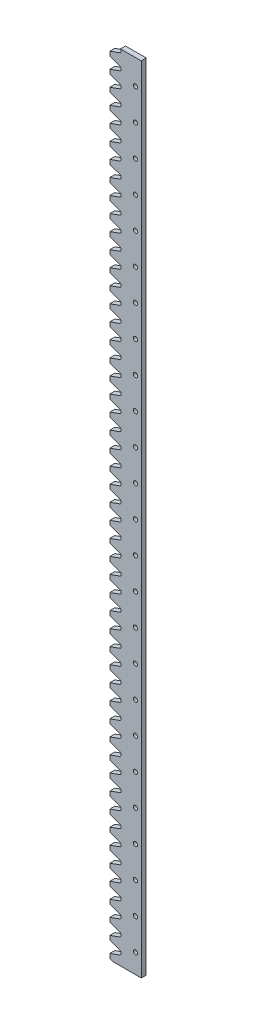
from build123d import *

# Parameters (mm, degrees)
CI_DEPTH                   = 1.5
CI_DEPTH_BACK              = 1.5
SKETCHCI_M_STRSKETCHNAME_W = 22.049999955
SKETCHCI_M_STRSKETCHNAME_H = 565.486669154
CUT_EXTRUDE_547_DEPTH      = 1.5
PATTERN_LINEAR_604_COUNT   = 60
PATTERN_LINEAR_604_PITCH   = 9.424777961
SKETCH_1_R                 = 1.275
SKETCH_1_W                 = 22.049999955
SKETCH_1_H                 = 12.569555851
SKETCH_1_H_2               = 53.917113303
CUT_EXTRUDE_1_DEPTH        = 562.105779584
SKETCH_2_W                 = 3.05
SKETCH_2_H                 = 499
CUT_EXTRUDE_2_DEPTH        = 10
SKETCH_3_W                 = 35.848320486
SKETCH_3_H                 = 14.718370521
SKETCH_3_W_2               = 40.105806215
SKETCH_3_H_2               = 50.96151316
CUT_EXTRUDE_3_DEPTH        = 10


with BuildPart() as part:
    # SketchCI.m_strSketchName → 拉伸CI (new, two sides: drawn at the far end of the back side and taken through both)
    with BuildSketch(Plane.XY.offset(-CI_DEPTH_BACK)):
        with Locations((8.025000023, -278.030945667)):
            Rectangle(SKETCHCI_M_STRSKETCHNAME_W, SKETCHCI_M_STRSKETCHNAME_H)
    extrude(amount=CI_DEPTH + CI_DEPTH_BACK)

    # Sketch 439 → Cut-Extrude 547 (cut, symmetric)
    with BuildSketch(Plane.XY):
        with BuildLine():
            Line((-2.999999955, 3.448105141), (-2.999999955, -3.448105141))
            Line((-2.999999955, -3.448105141), (3.157818082, -1.206842668))
            ThreePointArc((3.157818082, -1.206842668), (3.587236786, -0.877338107), (3.749999944, -0.361119322))
            Line((3.749999944, -0.361119322), (3.749999944, 0.361119322))
            ThreePointArc((3.749999944, 0.361119322), (3.587236786, 0.877338107), (3.157818082, 1.206842668))
            Line((3.157818082, 1.206842668), (-2.999999955, 3.448105141))
        make_face()
    cut_extrude_547 = extrude(amount=CUT_EXTRUDE_547_DEPTH, both=True, mode=Mode.SUBTRACT)

    # Pattern Linear 604: Cut-Extrude 547 ×60
    with Locations(*[(0, -i * PATTERN_LINEAR_604_PITCH, 0) for i in range(1, PATTERN_LINEAR_604_COUNT)]):
        add(cut_extrude_547, mode=Mode.SUBTRACT)

    # 草图1 → 切除-拉伸1 (cut, through all)
    with BuildSketch(Plane.XY.offset(1.5)):
        with Locations((12.5, -14.137166941)):
            Circle(SKETCH_1_R)
        with Locations((12.5, -32.977166941)):
            Circle(SKETCH_1_R)
        with Locations((12.5, -51.817166941)):
            Circle(SKETCH_1_R)
        with Locations((12.5, -70.657166941)):
            Circle(SKETCH_1_R)
        with Locations((12.5, -89.497166941)):
            Circle(SKETCH_1_R)
        with Locations((12.5, -108.337166941)):
            Circle(SKETCH_1_R)
        with Locations((12.5, -127.177166941)):
            Circle(SKETCH_1_R)
        with Locations((12.5, -146.017166941)):
            Circle(SKETCH_1_R)
        with Locations((12.5, -164.857166941)):
            Circle(SKETCH_1_R)
        with Locations((12.5, -183.697166941)):
            Circle(SKETCH_1_R)
        with Locations((12.5, -202.537166941)):
            Circle(SKETCH_1_R)
        with Locations((12.5, -221.377166941)):
            Circle(SKETCH_1_R)
        with Locations((12.5, -240.217166941)):
            Circle(SKETCH_1_R)
        with Locations((12.5, -259.057166941)):
            Circle(SKETCH_1_R)
        with Locations((12.5, -277.897166941)):
            Circle(SKETCH_1_R)
        with Locations((12.5, -296.737166941)):
            Circle(SKETCH_1_R)
        with Locations((12.5, -315.577166941)):
            Circle(SKETCH_1_R)
        with Locations((12.5, -334.417166941)):
            Circle(SKETCH_1_R)
        with Locations((12.5, -353.257166941)):
            Circle(SKETCH_1_R)
        with Locations((12.5, -372.097166941)):
            Circle(SKETCH_1_R)
        with Locations((12.5, -390.937166941)):
            Circle(SKETCH_1_R)
        with Locations((12.5, -409.777166941)):
            Circle(SKETCH_1_R)
        with Locations((12.5, -428.617166941)):
            Circle(SKETCH_1_R)
        with Locations((12.5, -447.457166941)):
            Circle(SKETCH_1_R)
        with Locations((12.5, -466.297166941)):
            Circle(SKETCH_1_R)
        with Locations((12.5, -485.137166941)):
            Circle(SKETCH_1_R)
        with Locations((12.5, -503.977166941)):
            Circle(SKETCH_1_R)
        with Locations((8.025000023, -1.572389016)):
            Rectangle(SKETCH_1_W, SKETCH_1_H)
        with Locations((8.025000023, -533.815723593)):
            Rectangle(SKETCH_1_W, SKETCH_1_H_2)
    extrude(amount=-CUT_EXTRUDE_1_DEPTH, mode=Mode.SUBTRACT)

    # 草图2 → 切除-拉伸2 (cut)
    with BuildSketch(Plane.XY.offset(1.5)):
        with Locations((17.525, -257.357166941)):
            Rectangle(SKETCH_2_W, SKETCH_2_H)
    extrude(amount=-CUT_EXTRUDE_2_DEPTH, mode=Mode.SUBTRACT)

    # 草图3 → 切除-拉伸3 (cut)
    with BuildSketch(Plane.XY.offset(1.5)):
        with Locations((3.970203735, -10.497981681)):
            Rectangle(SKETCH_3_W, SKETCH_3_H)
        with Locations((5.853128924, -522.337923521)):
            Rectangle(SKETCH_3_W_2, SKETCH_3_H_2)
    extrude(amount=-CUT_EXTRUDE_3_DEPTH, mode=Mode.SUBTRACT)


solid = part.part
